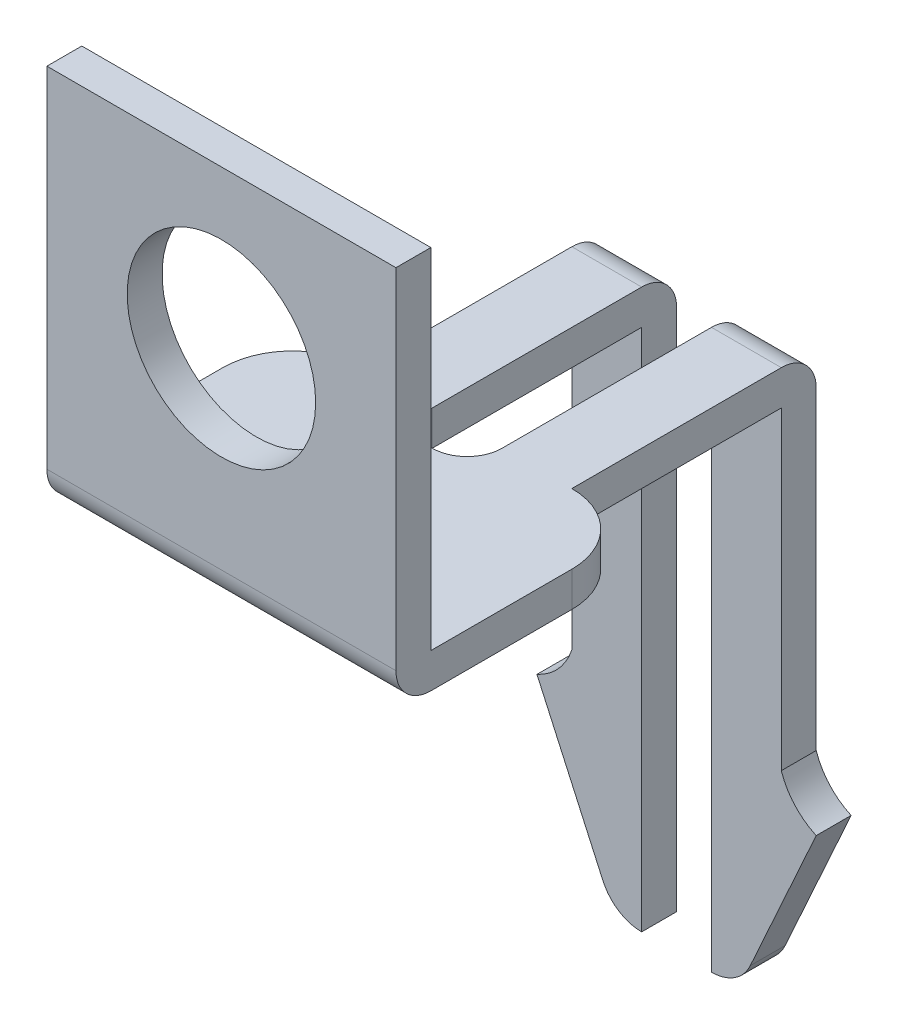
from build123d import *

# Parameters (mm, degrees)
ESBO_O1_W                = 5
ESBO_O1_H                = 5.5
ESBO_O1_R                = 1.35
RESSALTO_EXTRUS_O1_DEPTH = 0.5
ESBO_O2_W                = 5
ESBO_O2_H                = 0.5
RESSALTO_EXTRUS_O2_DEPTH = 6.52
FILETE3_R                = 0.5
CORTE_EXTRUS_O1_DEPTH    = 9.973873188
CORTE_EXTRUS_O2_DEPTH    = 9.973873188
ESBO_O5_W                = 1
ESBO_O5_H                = 0.5
RESSALTO_EXTRUS_O3_DEPTH = 7.5
FILETE4_R                = 0.5
ESBO_O6_W                = 1.52
ESBO_O6_H                = 3
RESSALTO_EXTRUS_O4_DEPTH = 0.5
CORTE_EXTRUS_O3_DEPTH    = 13.672525399
FILETE4_OF_ESPELHAR2_R   = 0.5


with BuildPart() as part:
    # Esboço1 → Ressalto-extrusão1 (new body)
    with BuildSketch(Plane.XY):
        Rectangle(ESBO_O1_W, ESBO_O1_H)
        with Locations((0, 0.5)):
            Circle(ESBO_O1_R, mode=Mode.SUBTRACT)
    extrude(amount=-RESSALTO_EXTRUS_O1_DEPTH)

    # Esboço2 → Ressalto-extrusão2 (add)
    with BuildSketch(Plane(origin=(0, 0, -0.5), x_dir=(-1, 0, 0), z_dir=(0, 0, -1))):
        with Locations((0, -2.5)):
            Rectangle(ESBO_O2_W, ESBO_O2_H)
    extrude(amount=RESSALTO_EXTRUS_O2_DEPTH)

    # Filete3
    filete3_edges = [part.edges().sort_by_distance(p)[0] for p in [
        (0, -2.75, 0),
    ]]
    fillet(filete3_edges, radius=FILETE3_R)

    # Esboço3 → Corte-extrusão1 (cut, through all)
    with BuildSketch(Plane(origin=(0, -2.25, 0), x_dir=(1, 0, 0), z_dir=(0, 1, 0))):
        with BuildLine():
            Line((-0.5, 7.02), (-0.5, 3.52))
            ThreePointArc((-0.5, 3.52), (0, 3.02), (0.5, 3.52))
            Line((0.5, 3.52), (0.5, 7.02))
            Line((0.5, 7.02), (-0.5, 7.02))
        make_face()
    extrude(amount=-CORTE_EXTRUS_O1_DEPTH, mode=Mode.SUBTRACT)

    # Esboço4 → Corte-extrusão2 (cut, through all)
    with BuildSketch(Plane(origin=(0, -2.25, 0), x_dir=(1, 0, 0), z_dir=(0, 1, 0))):
        with BuildLine():
            Line((1.5, 7.02), (1.5, 3.52))
            ThreePointArc((1.5, 3.52), (2.207106781, 3.227106781), (2.5, 2.52))
            Line((2.5, 2.52), (2.5, 7.02))
            Line((2.5, 7.02), (1.5, 7.02))
        make_face()
    corte_extrus_o2 = extrude(amount=-CORTE_EXTRUS_O2_DEPTH, mode=Mode.SUBTRACT)

    # Espelhar1: Corte-extrusão2 across plane
    add(corte_extrus_o2.mirror(Plane(origin=(0, 0, 0), x_dir=(0, 0, 1), z_dir=(1, 0, 0))), mode=Mode.SUBTRACT)

    # Esboço5 → Ressalto-extrusão3 (add)
    with BuildSketch(Plane.XZ.offset(2.75)):
        with Locations((-1, -6.77)):
            Rectangle(ESBO_O5_W, ESBO_O5_H)
    ressalto_extrus_o3 = extrude(amount=RESSALTO_EXTRUS_O3_DEPTH)

    # Filete4
    filete4_edges = [part.edges().sort_by_distance(p)[0] for p in [
        (-1, -2.25, -7.02),
    ]]
    fillet(filete4_edges, radius=FILETE4_R)

    # Esboço6 → Ressalto-extrusão4 (add)
    with BuildSketch(Plane(origin=(0, 0, -7.02), x_dir=(-1, 0, 0), z_dir=(0, 0, -1))):
        with Locations((1.26, -8.75)):
            Rectangle(ESBO_O6_W, ESBO_O6_H)
    ressalto_extrus_o4 = extrude(amount=-RESSALTO_EXTRUS_O4_DEPTH)

    # Esboço7 → Corte-extrusão3 (cut, through all)
    with BuildSketch(Plane(origin=(0, 0, -7.02), x_dir=(-1, 0, 0), z_dir=(0, 0, -1))):
        with BuildLine():
            Line((1.5, -7.25), (2.02, -7.25))
            Line((2.02, -7.25), (2.02, -10.25))
            Line((2.02, -10.25), (0.5, -10.25))
            ThreePointArc((0.5, -10.25), (0.830266035, -10.152734868), (1.055096438, -9.891990837))
            Line((1.055096438, -9.891990837), (2, -7.805096438))
            ThreePointArc((2, -7.805096438), (1.691943399, -7.579842376), (1.5, -7.25))
        make_face()
    corte_extrus_o3 = extrude(amount=-CORTE_EXTRUS_O3_DEPTH, mode=Mode.SUBTRACT)

    # Espelhar2: Ressalto-extrusão3, Ressalto-extrusão4, Corte-extrusão3 across plane
    add(ressalto_extrus_o3.mirror(Plane(origin=(0, 0, 0), x_dir=(0, 0, 1), z_dir=(1, 0, 0))))
    add(ressalto_extrus_o4.mirror(Plane(origin=(0, 0, 0), x_dir=(0, 0, 1), z_dir=(1, 0, 0))))
    add(corte_extrus_o3.mirror(Plane(origin=(0, 0, 0), x_dir=(0, 0, 1), z_dir=(1, 0, 0))), mode=Mode.SUBTRACT)

    # Filete4 of Espelhar2
    filete4_of_espelhar2_edges = [part.edges().sort_by_distance(p)[0] for p in [
        (1, -2.25, -7.02),
    ]]
    fillet(filete4_of_espelhar2_edges, radius=FILETE4_OF_ESPELHAR2_R)


solid = part.part
